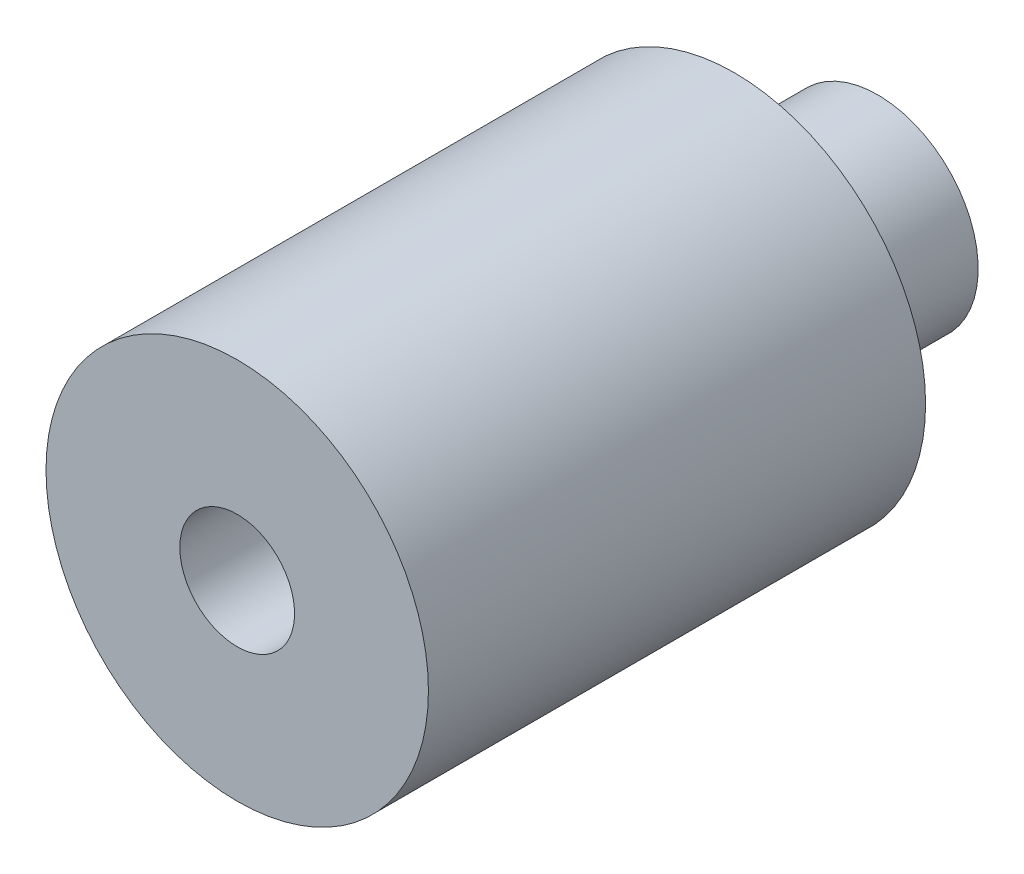
from build123d import *

# Parameters (mm, degrees)
SKETCH_1_R          = 10
EXTRUDE_1_DEPTH     = 26
SKETCH_2_R          = 5.25
EXTRUDE_2_DEPTH     = 7.5
SKETCH_3_R          = 3
CUT_EXTRUDE_1_DEPTH = 37.362755671


with BuildPart() as part:
    # 草图1 → 凸台-拉伸1 (new body)
    with BuildSketch(Plane.XY):
        with Locations(Location((0, 0, 0), (0, 0, 180))):
            Circle(SKETCH_1_R)
    extrude(amount=EXTRUDE_1_DEPTH)

    # 草图2 → 凸台-拉伸2 (add)
    with BuildSketch(Plane(origin=(0, 0, 0), x_dir=(-1, 0, 0), z_dir=(0, 0, -1))):
        Circle(SKETCH_2_R)
    extrude(amount=EXTRUDE_2_DEPTH)

    # 草图3 → 切除-拉伸1 (cut, through all)
    with BuildSketch(Plane(origin=(0, 0, -7.5), x_dir=(-1, 0, 0), z_dir=(0, 0, -1))):
        Circle(SKETCH_3_R)
    extrude(amount=-CUT_EXTRUDE_1_DEPTH, mode=Mode.SUBTRACT)


solid = part.part
